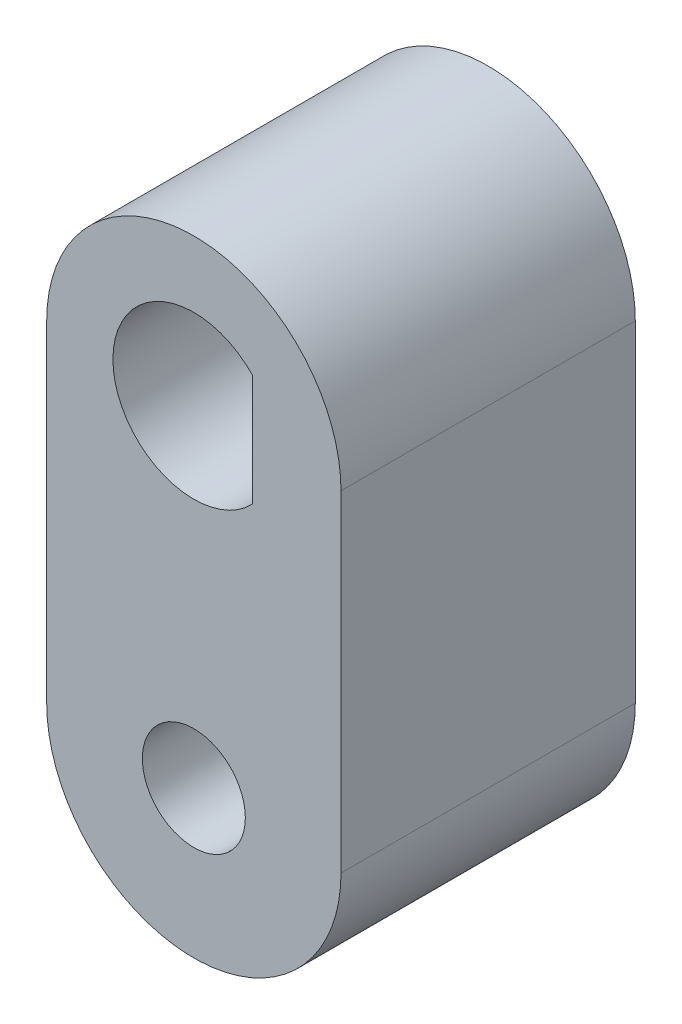
from build123d import *

# Parameters (mm, degrees)
EXTRUDE_2_DEPTH     = 8
SKETCH_1_6_R        = 1.4
CUT_EXTRUDE_2_DEPTH = 8


with BuildPart() as part:
    # 草图1 → 凸台-拉伸2 (new body)
    with BuildSketch(Plane.XY):
        with BuildLine():
            Line((4, 0), (4, -9))
            ThreePointArc((4, -9), (0, -13), (-4, -9))
            Line((-4, -9), (-4, 0))
            ThreePointArc((-4, 0), (0, 4), (4, 0))
        make_face()
    extrude(amount=EXTRUDE_2_DEPTH)

    # 草图1<6> → 切除-拉伸2 (cut)
    with BuildSketch(Plane.XY):
        with BuildLine():
            Line((1.6, -1.509966887), (1.6, 1.509966887))
            ThreePointArc((1.6, 1.509966887), (-2.2, 0), (1.6, -1.509966887))
        make_face()
        with Locations((0, -9)):
            Circle(SKETCH_1_6_R)
    extrude(amount=CUT_EXTRUDE_2_DEPTH, mode=Mode.SUBTRACT)


solid = part.part
